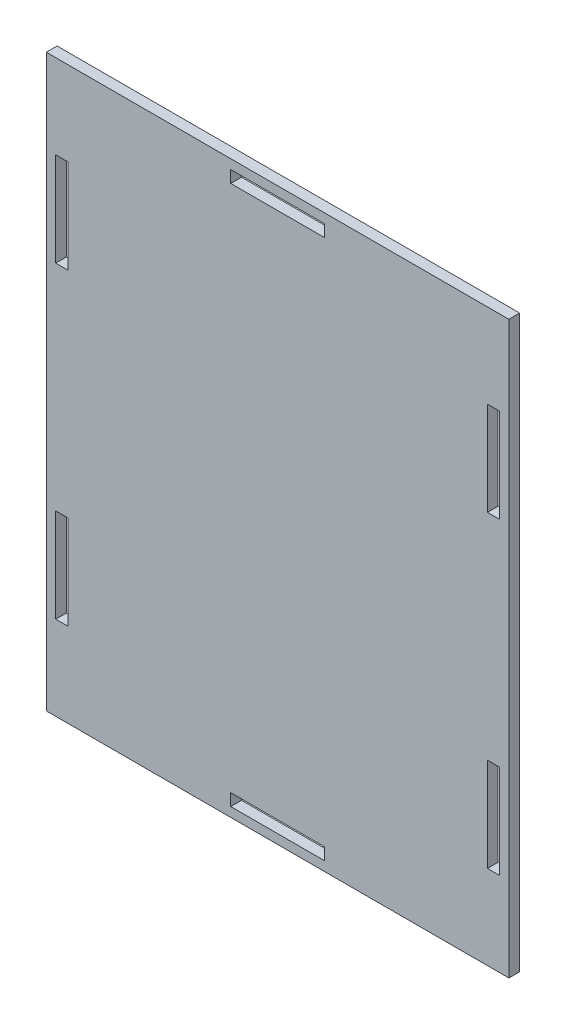
from build123d import *

# Parameters (mm, degrees)
SKETCH_1_W      = 150
SKETCH_1_H      = 185
SKETCH_1_W_2    = 3.9
SKETCH_1_H_2    = 30.4
SKETCH_1_W_3    = 30.4
SKETCH_1_H_3    = 3.9
EXTRUDE_1_DEPTH = 3.5


with BuildPart() as part:
    # Эскиз1 → Бобышка-Вытянуть1 (new body)
    with BuildSketch(Plane.XY):
        with Locations((75, 92.5)):
            Rectangle(SKETCH_1_W, SKETCH_1_H)
        with Locations((5, 42.5)):
            Rectangle(SKETCH_1_W_2, SKETCH_1_H_2, mode=Mode.SUBTRACT)
        with Locations((5, 142.5)):
            Rectangle(SKETCH_1_W_2, SKETCH_1_H_2, mode=Mode.SUBTRACT)
        with Locations((145, 42.5)):
            Rectangle(SKETCH_1_W_2, SKETCH_1_H_2, mode=Mode.SUBTRACT)
        with Locations((145, 142.5)):
            Rectangle(SKETCH_1_W_2, SKETCH_1_H_2, mode=Mode.SUBTRACT)
        with Locations((75, 5)):
            Rectangle(SKETCH_1_W_3, SKETCH_1_H_3, mode=Mode.SUBTRACT)
        with Locations((75, 180)):
            Rectangle(SKETCH_1_W_3, SKETCH_1_H_3, mode=Mode.SUBTRACT)
    extrude(amount=EXTRUDE_1_DEPTH)


solid = part.part
